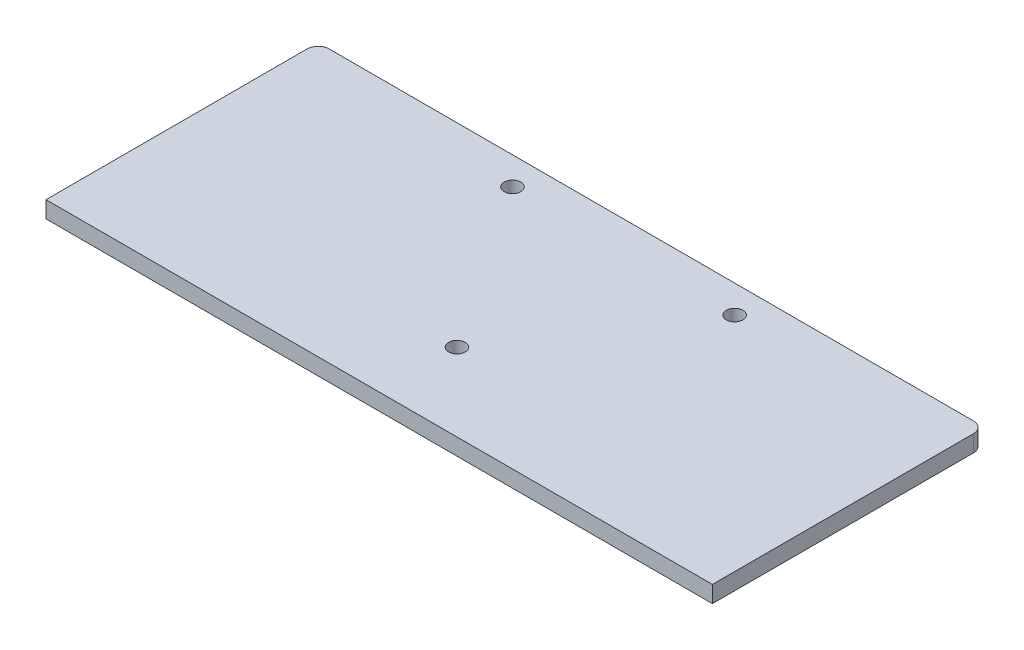
from build123d import *

# Parameters (mm, degrees)
SKETCH_1_W          = 120
SKETCH_1_H          = 49
EXTRUDE_1_DEPTH     = 3
SKETCH_2_R          = 1.5
CUT_EXTRUDE_1_DEPTH = 3
FILLET_1_R          = 2


with BuildPart() as part:
    # 草图1 → 凸台-拉伸1 (new body)
    with BuildSketch(Plane(origin=(0, 0, 0), x_dir=(1, 0, 0), z_dir=(0, 1, 0))):
        with Locations((24.718351515, -2.615392567)):
            Rectangle(SKETCH_1_W, SKETCH_1_H)
    extrude(amount=EXTRUDE_1_DEPTH)

    # 草图2 → 切除-拉伸1 (cut)
    with BuildSketch(Plane(origin=(0, 3, 0), x_dir=(1, 0, 0), z_dir=(0, 1, 0))):
        with Locations(Location((4.718351515, 16.884607433, 0), (0, 0, 270))):
            Circle(SKETCH_2_R)
        with Locations(Location((44.718351515, 16.884607433, 0), (0, 0, 270))):
            Circle(SKETCH_2_R)
        with Locations(Location((24.718351515, -13.115392567, 0), (0, 0, 270))):
            Circle(SKETCH_2_R)
    extrude(amount=-CUT_EXTRUDE_1_DEPTH, mode=Mode.SUBTRACT)

    # 圆角1
    fillet_1_edges = [part.edges().sort_by_distance(p)[0] for p in [
        (-35.281648485, 1.5, -21.884607433),
        (84.718351515, 1.5, -21.884607433),
    ]]
    fillet(fillet_1_edges, radius=FILLET_1_R)


solid = part.part
